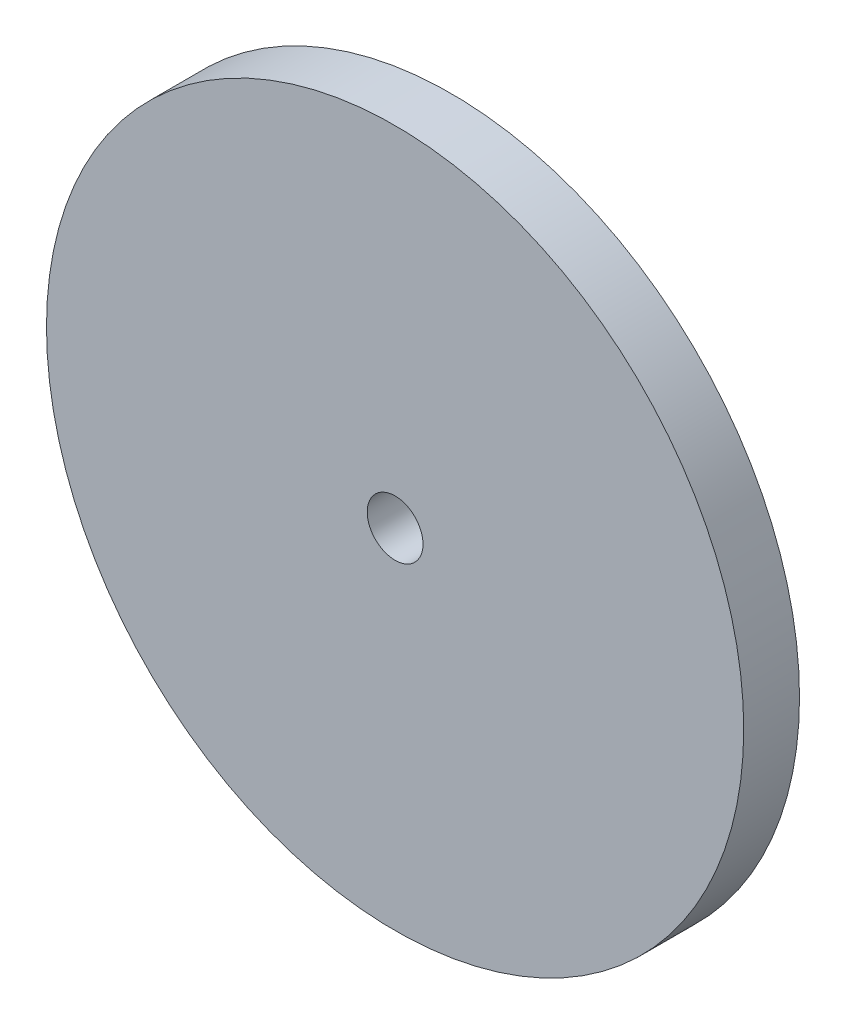
from build123d import *

# Parameters (mm, degrees)
SKETCH_1_R      = 125
SKETCH_1_R_2    = 10
EXTRUDE_1_DEPTH = 20


with BuildPart() as part:
    # 草图1 → 凸台-拉伸1 (new body)
    with BuildSketch(Plane.XY):
        Circle(SKETCH_1_R)
        Circle(SKETCH_1_R_2, mode=Mode.SUBTRACT)
    extrude(amount=EXTRUDE_1_DEPTH)


solid = part.part
